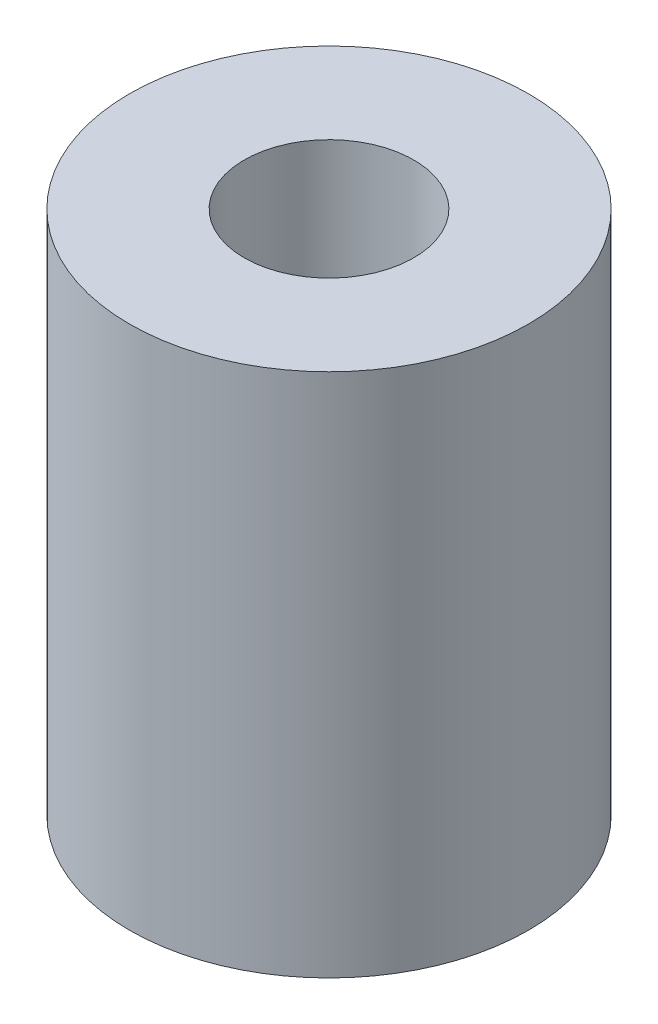
from build123d import *

# Parameters (mm, degrees)
SKETCH1_R           = 9.4107
SKETCH1_R_2         = 2.5
BOSS_EXTRUDE1_DEPTH = 24.765
SKETCH2_R           = 4
CUT_EXTRUDE1_DEPTH  = 12.7


with BuildPart() as part:
    # Sketch1 → Boss-Extrude1 (new body)
    with BuildSketch(Plane(origin=(0, 0, 0), x_dir=(1, 0, 0), z_dir=(0, 1, 0))):
        with Locations(Location((0, 0, 0), (0, 0, 270))):
            Circle(SKETCH1_R)
        with Locations(Location((0, 0, 0), (0, 0, 270))):
            Circle(SKETCH1_R_2, mode=Mode.SUBTRACT)
    extrude(amount=BOSS_EXTRUDE1_DEPTH)

    # Sketch2 → Cut-Extrude1 (cut)
    with BuildSketch(Plane(origin=(0, 24.765, 0), x_dir=(1, 0, 0), z_dir=(0, 1, 0))):
        with Locations(Location((0, 0, 0), (0, 0, 270))):
            Circle(SKETCH2_R)
    extrude(amount=-CUT_EXTRUDE1_DEPTH, mode=Mode.SUBTRACT)


solid = part.part
